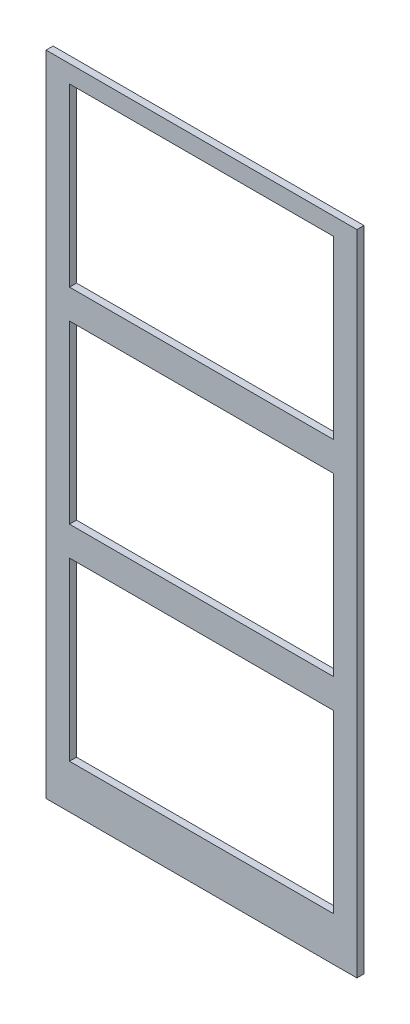
from build123d import *

# Parameters (mm, degrees)
ESBO_O1_W                = 265
ESBO_O1_H                = 552.5
ESBO_O1_W_2              = 225
ESBO_O1_H_2              = 150
RESSALTO_EXTRUS_O1_DEPTH = 6


with BuildPart() as part:
    # Esboço1 → Ressalto-extrusão1 (new body)
    with BuildSketch(Plane.XY):
        with Locations((134.750272405, 275.327419224)):
            Rectangle(ESBO_O1_W, ESBO_O1_H)
        with Locations((134.750272405, 286.577419224)):
            Rectangle(ESBO_O1_W_2, ESBO_O1_H_2, mode=Mode.SUBTRACT)
        with Locations((134.750272405, 111.577419224)):
            Rectangle(ESBO_O1_W_2, ESBO_O1_H_2, mode=Mode.SUBTRACT)
        with Locations((134.750272405, 461.577419224)):
            Rectangle(ESBO_O1_W_2, ESBO_O1_H_2, mode=Mode.SUBTRACT)
    extrude(amount=RESSALTO_EXTRUS_O1_DEPTH)


solid = part.part
